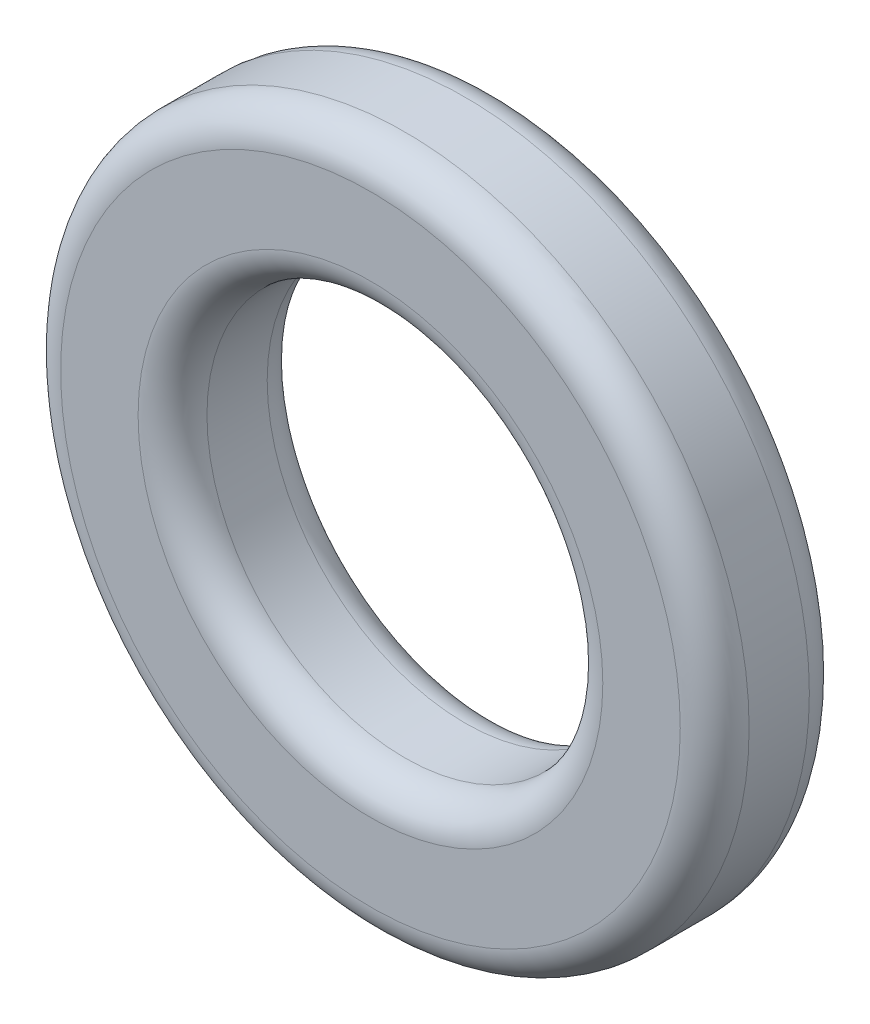
from build123d import *

# Parameters (mm, degrees)
SKETCH2_R           = 4
SKETCH2_R_2         = 2.3
BOSS_EXTRUDE1_DEPTH = 1.5
FILLET1_R           = 0.4


with BuildPart() as part:
    # Sketch2 → Boss-Extrude1 (new body)
    with BuildSketch(Plane.XY):
        Circle(SKETCH2_R)
        Circle(SKETCH2_R_2, mode=Mode.SUBTRACT)
    extrude(amount=BOSS_EXTRUDE1_DEPTH)

    # Fillet1
    fillet1_edges = [part.edges().sort_by_distance(p)[0] for p in [
        (-4, 0, 0),
        (-4, 0, 1.5),
        (-2.3, 0, 0),
        (-2.3, 0, 1.5),
    ]]
    fillet(fillet1_edges, radius=FILLET1_R)


solid = part.part
